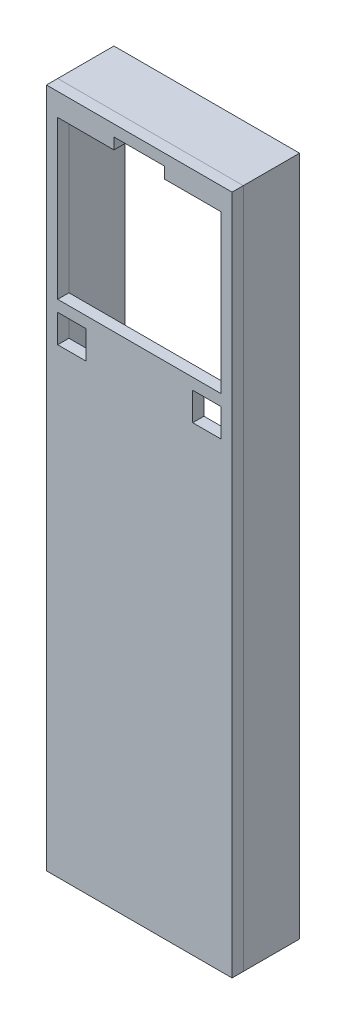
from build123d import *

# Parameters (mm, degrees)
ESBO_O1_W                  = 33
ESBO_O1_H                  = 121
RESSALTO_EXTRUS_O1_DEPTH   = 10
ESBO_O1_4_R                = 1.5
RESSALTO_EXTRUS_O2_DEPTH   = 2.5
RESSALTO_EXTRUS_O2_2_DEPTH = 2.5
ESBO_O1_4_R_2              = 2
RESSALTO_EXTRUS_O2_3_DEPTH = 2.5
RESSALTO_EXTRUS_O2_4_DEPTH = 2.5
ESBO_O2_W                  = 33
ESBO_O2_H                  = 121
ESBO_O2_W_2                = 5
ESBO_O2_H_2                = 5
RESSALTO_EXTRUS_O8_DEPTH   = 2


with BuildPart() as part:
    # Esboço1 → Ressalto-extrusão1 (new body)
    with BuildSketch(Plane.XY):
        with Locations((14.5, 58.5)):
            Rectangle(ESBO_O1_W, ESBO_O1_H)
        Polygon((0, 0), (0, 115), (10, 115), (10, 117), (19, 117), (19, 115), (29, 115), (29, 0), align=None, mode=Mode.SUBTRACT)
    extrude(amount=-RESSALTO_EXTRUS_O1_DEPTH)


with BuildPart() as body_2:
    # Esboço1<4> → Ressalto-extrusão2 (new body)
    with BuildSketch(Plane.XY):
        with Locations((1.5, 1.5)):
            Circle(ESBO_O1_4_R)
    extrude(amount=-RESSALTO_EXTRUS_O2_DEPTH)


with BuildPart() as body_3:
    # Esboço1<4> → Ressalto-extrus_o2 2 (new body)
    with BuildSketch(Plane.XY):
        with Locations((27.5, 1.5)):
            Circle(ESBO_O1_4_R)
    extrude(amount=-RESSALTO_EXTRUS_O2_2_DEPTH)


with BuildPart() as body_4:
    # Esboço1<4> → Ressalto-extrus_o2 3 (new body)
    with BuildSketch(Plane.XY):
        with Locations((10, 82.5)):
            Circle(ESBO_O1_4_R_2)
    extrude(amount=-RESSALTO_EXTRUS_O2_3_DEPTH)


with BuildPart() as body_5:
    # Esboço1<4> → Ressalto-extrus_o2 4 (new body)
    with BuildSketch(Plane.XY):
        with Locations((19, 82.5)):
            Circle(ESBO_O1_4_R_2)
    extrude(amount=-RESSALTO_EXTRUS_O2_4_DEPTH)


with BuildPart() as body_6:
    # Esboço2 → Ressalto-extrusão8 (new body)
    with BuildSketch(Plane.XY):
        with Locations((14.5, 58.5)):
            Rectangle(ESBO_O2_W, ESBO_O2_H)
        with Locations((2.5, 82.5)):
            Rectangle(ESBO_O2_W_2, ESBO_O2_H_2, mode=Mode.SUBTRACT)
        with Locations((26.5, 82.5)):
            Rectangle(ESBO_O2_W_2, ESBO_O2_H_2, mode=Mode.SUBTRACT)
        Polygon((0, 115), (10, 115), (10, 117), (19, 117), (19, 115), (29, 115), (29, 87), (0, 87), align=None, mode=Mode.SUBTRACT)
    extrude(amount=RESSALTO_EXTRUS_O8_DEPTH)


solid = Compound([part.part, body_2.part, body_3.part, body_4.part, body_5.part, body_6.part])
